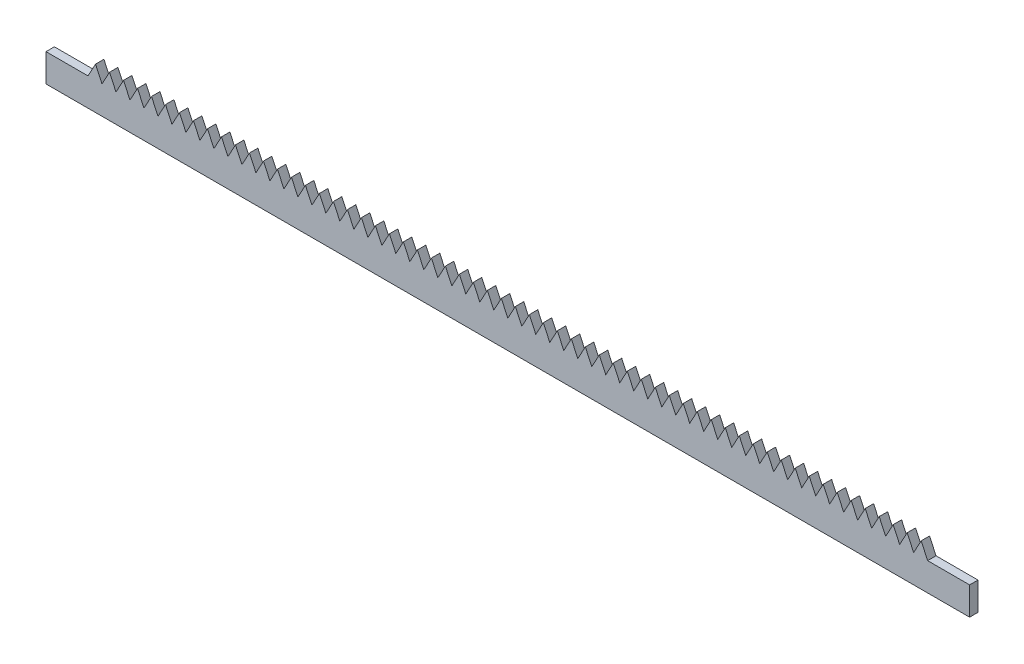
from build123d import *

# Parameters (mm, degrees)
SALIENTE_EXTRUIR1_DEPTH = 3


with BuildPart() as part:
    # Croquis1 → Saliente-Extruir1 (new body)
    with BuildSketch(Plane.XY):
        Polygon((-150, 2.5), (-165, 2.5), (-165, -7.5), (-150, -7.5), (150, -7.5), (165, -7.5), (165, 2.5), (150, 2.5), (147.707897557, 7.5), (145, 2.5), (142.707897557, 7.5), (140, 2.5), (137.707897557, 7.5), (135, 2.5), (132.707897557, 7.5), (130, 2.5), (127.707897557, 7.5), (125, 2.5), (122.707897557, 7.5), (120, 2.5), (117.707897557, 7.5), (115, 2.5), (112.707897557, 7.5), (110, 2.5), (107.707897557, 7.5), (105, 2.5), (102.707897557, 7.5), (100, 2.5), (97.707897557, 7.5), (95, 2.5), (92.707897557, 7.5), (90, 2.5), (87.707897557, 7.5), (85, 2.5), (82.707897557, 7.5), (80, 2.5), (77.707897557, 7.5), (75, 2.5), (72.707897557, 7.5), (70, 2.5), (67.707897557, 7.5), (65, 2.5), (62.707897557, 7.5), (60, 2.5), (57.707897557, 7.5), (55, 2.5), (52.707897557, 7.5), (50, 2.5), (47.707897557, 7.5), (45, 2.5), (42.707897557, 7.5), (40, 2.5), (37.707897557, 7.5), (35, 2.5), (32.707897557, 7.5), (30, 2.5), (27.707897557, 7.5), (25, 2.5), (22.707897557, 7.5), (20, 2.5), (17.707897557, 7.5), (15, 2.5), (12.707897557, 7.5), (10, 2.5), (7.707897557, 7.5), (5, 2.5), (2.707897557, 7.5), (0, 2.5), (-2.292102443, 7.5), (-5, 2.5), (-7.292102443, 7.5), (-10, 2.5), (-12.292102443, 7.5), (-15, 2.5), (-17.292102443, 7.5), (-20, 2.5), (-22.292102443, 7.5), (-25, 2.5), (-27.292102443, 7.5), (-30, 2.5), (-32.292102443, 7.5), (-35, 2.5), (-37.292102443, 7.5), (-40, 2.5), (-42.292102443, 7.5), (-45, 2.5), (-47.292102443, 7.5), (-50, 2.5), (-52.292102443, 7.5), (-55, 2.5), (-57.292102443, 7.5), (-60, 2.5), (-62.292102443, 7.5), (-65, 2.5), (-67.292102443, 7.5), (-70, 2.5), (-72.292102443, 7.5), (-75, 2.5), (-77.292102443, 7.5), (-80, 2.5), (-82.292102443, 7.5), (-85, 2.5), (-87.292102443, 7.5), (-90, 2.5), (-92.292102443, 7.5), (-95, 2.5), (-97.292102443, 7.5), (-100, 2.5), (-102.292102443, 7.5), (-105, 2.5), (-107.292102443, 7.5), (-110, 2.5), (-112.292102443, 7.5), (-115, 2.5), (-117.292102443, 7.5), (-120, 2.5), (-122.292102443, 7.5), (-125, 2.5), (-127.292102443, 7.5), (-130, 2.5), (-132.292102443, 7.5), (-135, 2.5), (-137.292102443, 7.5), (-140, 2.5), (-142.292102443, 7.5), (-145, 2.5), (-147.292102443, 7.5), align=None)
    extrude(amount=SALIENTE_EXTRUIR1_DEPTH)


solid = part.part
